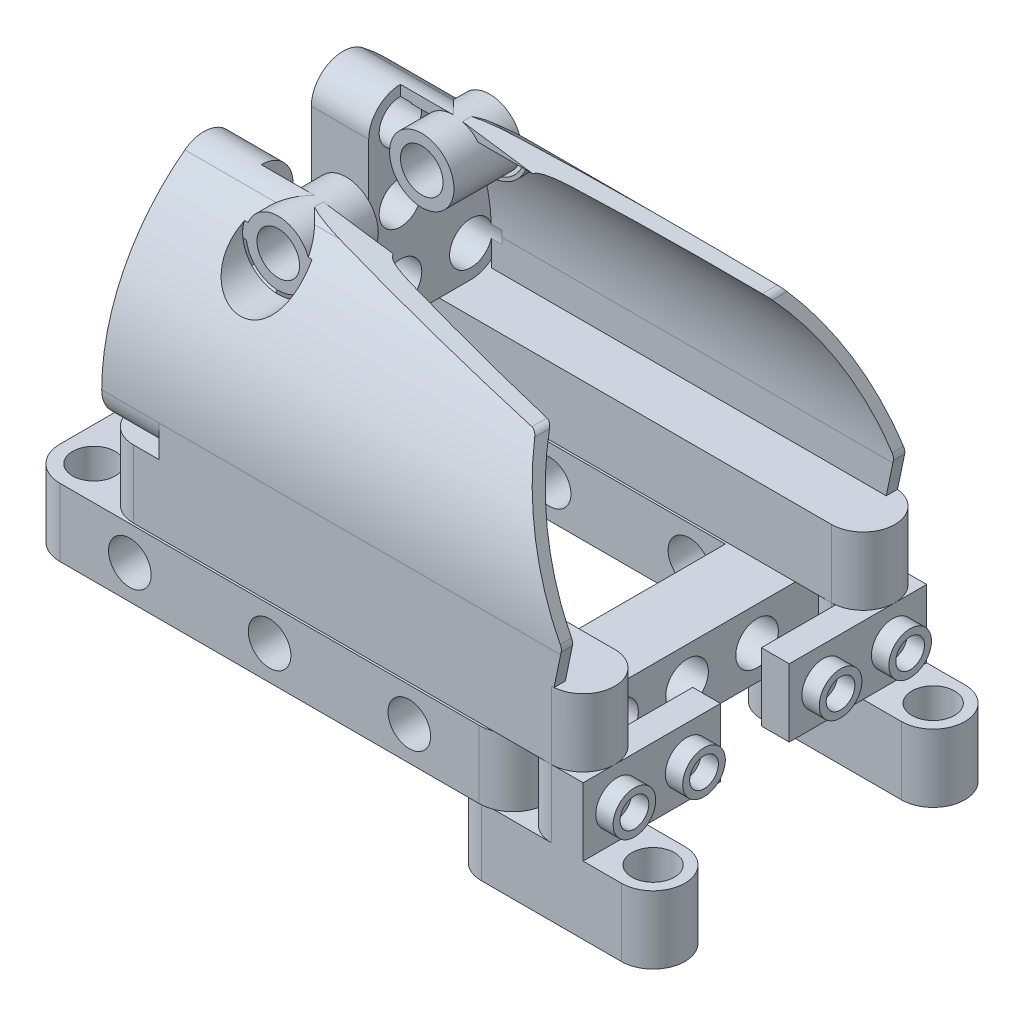
from build123d import *

# Parameters (mm, degrees)
BOSS_EXTRUDE1_DEPTH      = 7.8
BOSS_EXTRUDE2_DEPTH      = 7.8
BOSS_EXTRUDE3_DEPTH      = 7.8
BOSS_EXTRUDE4_DEPTH      = 6.6
BOSS_EXTRUDE8_DEPTH      = 46.3
CUT_EXTRUDE1_DEPTH       = 79.788926887
SKETCH12_R               = 3.7
BOSS_EXTRUDE25_DEPTH     = 7.8
BOSS_EXTRUDE26_REACH     = 79.235
SKETCH14_R               = 4.1
CUT_EXTRUDE2_DEPTH       = 5
SKETCH15_R               = 2.45
SKETCH15_R_2             = 1.65
BOSS_EXTRUDE27_DEPTH     = 2
HOLEWZD1_D               = 4.9
HOLEWZD1_DEPTH           = 7.85
HOLEWZD1_ON_FACE_2_D     = 4.9
HOLEWZD1_ON_FACE_2_DEPTH = 7.85
HOLEWZD1_ON_FACE_3_D     = 4.9
HOLEWZD1_ON_FACE_3_DEPTH = 7.85
HOLEWZD1_ON_FACE_4_D     = 4.9
HOLEWZD1_ON_FACE_4_DEPTH = 7.85
HOLEWZD1_ON_FACE_5_D     = 4.9
HOLEWZD1_ON_FACE_5_DEPTH = 7.85
HOLEWZD2_D               = 4.9
HOLEWZD2_DEPTH           = 7.85
HOLEWZD2_ON_FACE_2_D     = 4.9
HOLEWZD2_ON_FACE_2_DEPTH = 7.85


with BuildPart() as part:
    # Sketch1 → Boss-Extrude1 (new body)
    with BuildSketch(Plane(origin=(0, 0, 0), x_dir=(1, 0, 0), z_dir=(0, 1, 0))):
        with BuildLine():
            Line((-8.05, 3.65), (8.05, 3.65))
            ThreePointArc((8.05, 3.65), (11.7, 0), (8.05, -3.65))
            Line((8.05, -3.65), (-8.05, -3.65))
            ThreePointArc((-8.05, -3.65), (-11.7, 0), (-8.05, 3.65))
        make_face()
    extrude(amount=BOSS_EXTRUDE1_DEPTH)

    # Sketch2 → Boss-Extrude2 (add)
    with BuildSketch(Plane(origin=(0, 7.8, 0), x_dir=(1, 0, 0), z_dir=(0, 1, 0))):
        with BuildLine():
            Line((-8.05, 3.9), (-56.25, 3.9))
            ThreePointArc((-56.25, 3.9), (-59.007716447, 2.757716447), (-60.15, 0))
            Line((-60.15, 0), (-60.15, -16.1))
            Line((-60.15, -16.1), (-52.35, -16.1))
            Line((-52.35, -16.1), (-52.35, -3.9))
            Line((-52.35, -3.9), (-11.95, -3.9))
            Line((-11.95, -3.9), (-11.95, -16.1))
            Line((-11.95, -16.1), (-4.15, -16.1))
            Line((-4.15, -16.1), (-4.15, 0))
            ThreePointArc((-4.15, 0), (-5.292283553, 2.757716447), (-8.05, 3.9))
        make_face()
        with BuildLine():
            Line((0, 3.65), (3.65, 3.65))
            Line((3.65, 3.65), (3.65, -12.15))
            Line((3.65, -12.15), (0.45, -12.15))
            Line((0.45, -12.15), (0.45, -3.65))
            Line((0.45, -3.65), (0, -3.65))
            ThreePointArc((0, -3.65), (-3.65, 0), (0, 3.65))
        make_face()
    extrude(amount=BOSS_EXTRUDE2_DEPTH)

    # Sketch3 → Boss-Extrude3 (add)
    with BuildSketch(Plane(origin=(0, 15.6, 0), x_dir=(1, 0, 0), z_dir=(0, 1, 0))):
        with BuildLine():
            Line((-48.05, 3.65), (0, 3.65))
            ThreePointArc((0, 3.65), (3.65, 0), (0, -3.65))
            Line((0, -3.65), (-48.05, -3.65))
            ThreePointArc((-48.05, -3.65), (-51.7, 0), (-48.05, 3.65))
        make_face()
    extrude(amount=BOSS_EXTRUDE3_DEPTH)

    # Sketch5 → Boss-Extrude4 (add)
    with BuildSketch(Plane.ZY.offset(51.7)):
        with BuildLine():
            Line((0, 23.4), (8.1, 23.4))
            ThreePointArc((8.1, 23.4), (10.680939751, 24.469060249), (11.75, 27.05))
            Line((11.75, 27.05), (11.75, 43.25))
            ThreePointArc((11.75, 43.25), (9.732329624, 46.514659247), (5.91, 46.17))
            ThreePointArc((5.91, 46.17), (-1.126809865, 37.738404932), (-3.65, 27.05))
            ThreePointArc((-3.65, 27.05), (-2.580939751, 24.469060249), (0, 23.4))
        make_face()
    extrude(amount=-BOSS_EXTRUDE4_DEPTH)



with BuildPart() as body_2:
    # Sketch6 → Boss-Extrude8 (new body)
    with BuildSketch(Plane(origin=(-45.1, 0, 0), x_dir=(0, 0, -1), z_dir=(1, 0, 0))):
        with BuildLine():
            Line((-8.1, 45.6), (-8.1, 46.9))
            ThreePointArc((-8.1, 46.9), (-6.945768654, 46.712694038), (-5.91, 46.17))
            ThreePointArc((-5.91, 46.17), (1.126809865, 37.738404932), (3.65, 27.05))
            Line((3.65, 27.05), (3.65, 23.4))
            Line((3.65, 23.4), (2.35, 23.4))
            Line((2.35, 23.4), (2.35, 27.05))
            ThreePointArc((2.35, 27.05), (-0.035945483, 37.157027258), (-6.69, 45.13))
            ThreePointArc((-6.69, 45.13), (-7.35686475, 45.47940575), (-8.1, 45.6))
        make_face()
    extrude(amount=BOSS_EXTRUDE8_DEPTH)

    # Sketch11 → Cut-Extrude1 (cut, through all)
    with BuildSketch(Plane(origin=(0, 0, -3.65), x_dir=(-1, 0, 0), z_dir=(0, 0, -1))):
        with BuildLine():
            Line((39, 46.9), (7.878230294, 42.468102415))
            ThreePointArc((7.878230294, 42.468102415), (7.461644441, 42.308221238), (7.156073706, 41.983056219))
            Line((7.156073706, 41.983056219), (-1.005400081, 28.032630094))
            ThreePointArc((-1.005400081, 28.032630094), (-1.129246471, 27.68847224), (-1.121051389, 27.322801081))
            Line((-1.121051389, 27.322801081), (-0.3, 23.4))
            Line((-0.3, 23.4), (-1.2, 23.4))
            Line((-1.2, 23.4), (-1.2, 27.7))
            Line((-1.2, 27.7), (-1.2, 46.9))
            Line((-1.2, 46.9), (39, 46.9))
        make_face()
    extrude(amount=-CUT_EXTRUDE1_DEPTH, mode=Mode.SUBTRACT)


with BuildPart() as part_1:
    add(part.part)

    add(body_2.part)  # Boss-Extrude25 merges body 2
    # Sketch12 → Boss-Extrude25 (add)
    with BuildSketch(Plane.XY.offset(11.75)):
        with Locations((-39, 43.2)):
            Circle(SKETCH12_R)
    extrude(amount=-BOSS_EXTRUDE25_DEPTH)

    # Sketch13 → Boss-Extrude26 (add, up to next)
    with BuildSketch(Plane(origin=(0, 0, 3.95), x_dir=(-1, 0, 0), z_dir=(0, 0, -1)), mode=Mode.PRIVATE) as boss_extrude26_sk1:
        with BuildLine():
            Line((34.527339768, 42.704711751), (43.472660232, 42.704711751))
            ThreePointArc((43.472660232, 42.704711751), (39, 38.7), (34.527339768, 42.704711751))
        make_face()
    boss_extrude26_tool1 = extrude(boss_extrude26_sk1.sketch, amount=BOSS_EXTRUDE26_REACH, mode=Mode.PRIVATE) - part_1.part
    add(boss_extrude26_tool1.solids().sort_by_distance((-39, 41.019834, 3.95))[0])

    # Sketch14 → Cut-Extrude2 (cut)
    with BuildSketch(Plane.XY.offset(-1.05)):
        with Locations((-39, 43.2)):
            Circle(SKETCH14_R)
    extrude(amount=CUT_EXTRUDE2_DEPTH, mode=Mode.SUBTRACT)

    # Sketch15 → Boss-Extrude27 (add)
    # profile 1 of 2: a face of its own
    with BuildSketch(Plane(origin=(3.65, 0, 0), x_dir=(0, 0, -1), z_dir=(1, 0, 0))):
        with Locations((-8.25, 11.7)):
            Circle(SKETCH15_R)
        with Locations((-8.25, 11.7)):
            Circle(SKETCH15_R_2, mode=Mode.SUBTRACT)
    # profile 2 of 2: a face of its own
    with BuildSketch(Plane(origin=(3.65, 0, 0), x_dir=(0, 0, -1), z_dir=(1, 0, 0))):
        with Locations((-0.25, 11.7)):
            Circle(SKETCH15_R)
        with Locations((-0.25, 11.7)):
            Circle(SKETCH15_R_2, mode=Mode.SUBTRACT)
    extrude(amount=BOSS_EXTRUDE27_DEPTH)

    # HoleWzd1
    with Locations(Plane(origin=(-39, 43.2, 11.75), x_dir=(1, 0, 0), z_dir=(0, 0, 1))):
        with Locations((0, 0)):
            Hole(HOLEWZD1_D / 2, depth=HOLEWZD1_DEPTH)

    # HoleWzd1 on face 2
    with Locations(Plane(origin=(-51.7, 43.25, 8.1), x_dir=(0, 0, -1), z_dir=(-1, 0, 0))):
        with Locations((0, 0), (0, 8.1), (0, 16.2), (8.1, 16.2)):
            Hole(HOLEWZD1_ON_FACE_2_D / 2, depth=HOLEWZD1_ON_FACE_2_DEPTH)

    # HoleWzd1 on face 3
    with Locations(Plane(origin=(8.05, 0, 0), x_dir=(0, 0, -1), z_dir=(0, -1, 0))):
        with Locations((0, 0)):
            Hole(HOLEWZD1_ON_FACE_3_D / 2, depth=HOLEWZD1_ON_FACE_3_DEPTH)

    # HoleWzd1 on face 4
    with Locations(Plane(origin=(-32.15, 11.7, 3.9), x_dir=(1, 0, 0), z_dir=(0, 0, 1))):
        with Locations((0, 0), (-16.066666667, 0), (16.066666667, 0)):
            Hole(HOLEWZD1_ON_FACE_4_D / 2, depth=HOLEWZD1_ON_FACE_4_DEPTH)

    # HoleWzd1 on face 5
    with Locations(Plane(origin=(-56.25, 7.8, 0), x_dir=(0, 0, -1), z_dir=(0, -1, 0))):
        with Locations((0, 0), (0, 32.133333333)):
            Hole(HOLEWZD1_ON_FACE_5_D / 2, depth=HOLEWZD1_ON_FACE_5_DEPTH)

    # Mirror7: part across plane


with BuildPart() as part_2:
    add(part_1.part)
    add(part_1.part.mirror(Plane.XY.offset(16.1)))

    # HoleWzd2
    with Locations(Plane(origin=(-52.35, 11.7, 24.15), x_dir=(0, 0, 1), z_dir=(1, 0, 0))):
        with Locations((0, 0), (-8.05, 0), (-16.1, 0)):
            Hole(HOLEWZD2_D / 2, depth=HOLEWZD2_DEPTH)

    # HoleWzd2 on face 2
    with Locations(Plane(origin=(-11.95, 11.7, 16.1), x_dir=(0, 0, -1), z_dir=(-1, 0, 0))):
        with Locations((0, 0), (-8.05, 0), (8.05, 0)):
            Hole(HOLEWZD2_ON_FACE_2_D / 2, depth=HOLEWZD2_ON_FACE_2_DEPTH)


solid = part_2.part
